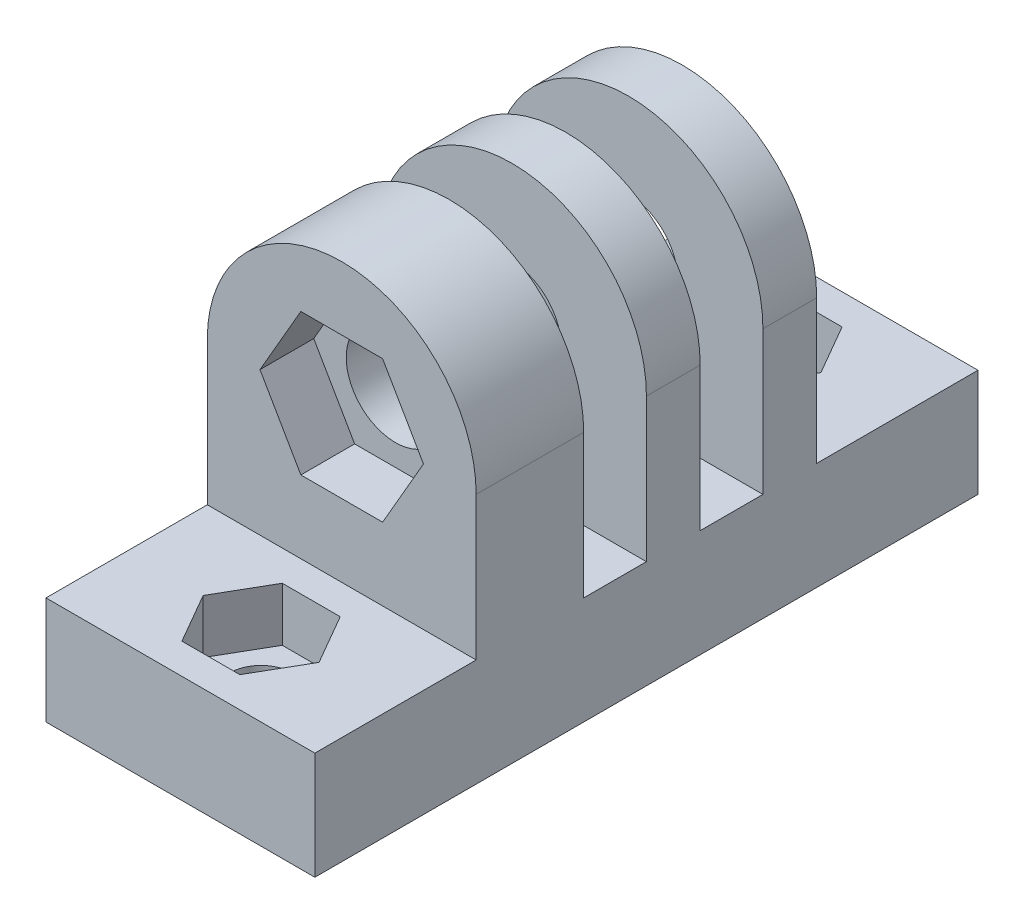
from build123d import *

# Parameters (mm, degrees)
ESQUISSE1_R                = 2.75
BOSS_EXTRU_1_DEPTH         = 3
ESQUISSE2_W                = 15
ESQUISSE2_H                = 25
BOSS_EXTRU_2_DEPTH         = 6
R_P_TITION_LIN_AIRE1_COUNT = 3
R_P_TITION_LIN_AIRE1_PITCH = 6.5
BOSS_EXTRU_3_DEPTH         = 3
ENL_V_MAT_EXTRU_1_DEPTH    = 3
ESQUISSE4_3_R              = 1.75
ENL_V_MAT_EXTRU_3_DEPTH    = 31.809901006


with BuildPart() as part:
    # Esquisse1 → Boss.-Extru.1 (new body)
    with BuildSketch(Plane.XY):
        with BuildLine():
            Line((0, 0), (15, 0))
            Line((15, 0), (15, 8))
            ThreePointArc((15, 8), (7.5, 15.5), (0, 8))
            Line((0, 8), (0, 0))
        make_face()
        with Locations((7.5, 8)):
            Circle(ESQUISSE1_R, mode=Mode.SUBTRACT)
    boss_extru_1 = extrude(amount=BOSS_EXTRU_1_DEPTH)

    # Esquisse2 → Boss.-Extru.2 (add)
    with BuildSketch(Plane.XZ):
        with Locations((7.5, -9.5)):
            Rectangle(ESQUISSE2_W, ESQUISSE2_H)
    boss_extru_2 = extrude(amount=BOSS_EXTRU_2_DEPTH)

    # Répétition linéaire1: Boss.-Extru.1 ×3
    with Locations(*[(0, 0, -i * R_P_TITION_LIN_AIRE1_PITCH) for i in range(1, R_P_TITION_LIN_AIRE1_COUNT)]):
        add(boss_extru_1)

    # Esquisse3 → Boss.-Extru.3 (add)
    with BuildSketch(Plane.XY.offset(3)):
        with BuildLine():
            Line((0, 8), (0, -6))
            Line((0, -6), (15, -6))
            Line((15, -6), (15, 8))
            ThreePointArc((15, 8), (7.5, 15.5), (0, 8))
        make_face()
        Polygon((9.780533563, 4.05), (12.061067127, 8), (9.780533563, 11.95), (5.219466437, 11.95), (2.938932873, 8), (5.219466437, 4.05), align=None, mode=Mode.SUBTRACT)
    extrude(amount=BOSS_EXTRU_3_DEPTH)

    # Esquisse4 → Enlèv. mat.-Extru.1 (cut)
    with BuildSketch(Plane(origin=(0, 0, 0), x_dir=(1, 0, 0), z_dir=(0, 1, 0))):
        Polygon((9.116580754, 14.7), (10.733161507, 17.5), (9.116580754, 20.3), (5.883419246, 20.3), (4.266838493, 17.5), (5.883419246, 14.7), align=None)
    enl_v_mat_extru_1 = extrude(amount=-ENL_V_MAT_EXTRU_1_DEPTH, mode=Mode.SUBTRACT)

    # Esquisse4<3> → Enlèv. mat.-Extru.3 (cut, through all)
    with BuildSketch(Plane(origin=(0, 0, 0), x_dir=(1, 0, 0), z_dir=(0, 1, 0))):
        with Locations((7.5, 17.5)):
            Circle(ESQUISSE4_3_R)
    enl_v_mat_extru_3 = extrude(amount=-ENL_V_MAT_EXTRU_3_DEPTH, mode=Mode.SUBTRACT)

    # Symétrie1: Boss.-Extru.2, Enlèv. mat.-Extru.1, Enlèv. mat.-Extru.3 across plane
    add(boss_extru_2.mirror(Plane(origin=(0, 0, -3.5), x_dir=(1, 0, 0), z_dir=(0, 0, -1))))
    add(enl_v_mat_extru_1.mirror(Plane(origin=(0, 0, -3.5), x_dir=(1, 0, 0), z_dir=(0, 0, -1))), mode=Mode.SUBTRACT)
    add(enl_v_mat_extru_3.mirror(Plane(origin=(0, 0, -3.5), x_dir=(1, 0, 0), z_dir=(0, 0, -1))), mode=Mode.SUBTRACT)


solid = part.part
